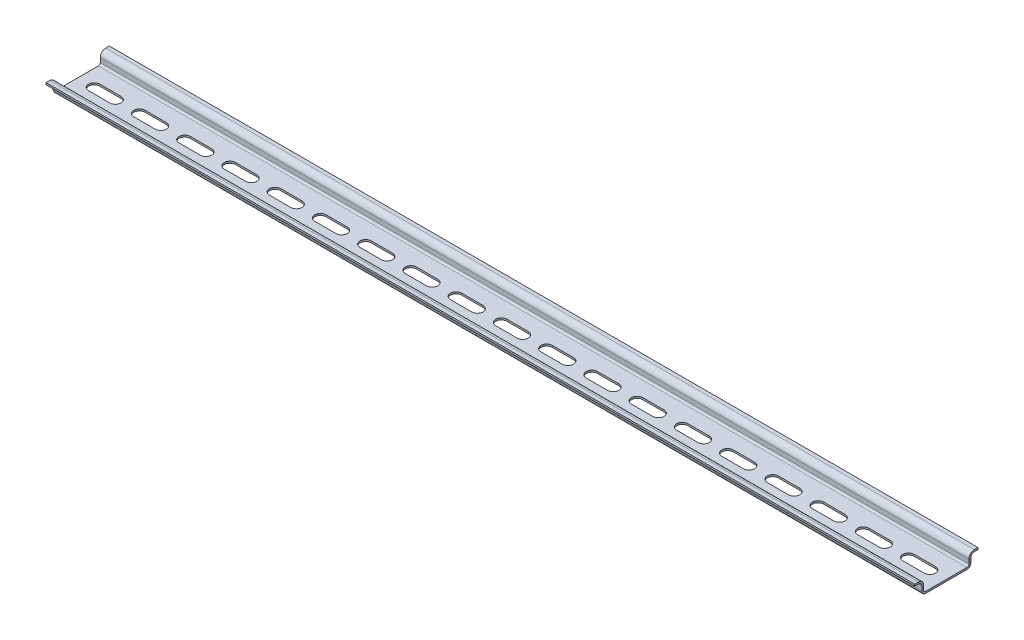
from build123d import *

# Parameters (mm, degrees)
EXTRUDE_THIN1_DEPTH      = 240
EXTRUDE_THIN1_DEPTH_BACK = 240
CUT_EXTRUDE1_REACH       = 242.754
LPATTERN1_COUNT          = 10
LPATTERN1_PITCH          = 25
LPATTERN1_COL_COUNT      = 10
LPATTERN1_COL_PITCH      = 25


with BuildPart() as part:
    # Sketch1 → Extrude-Thin1 (new, two sides: drawn at the far end of the back side and taken through both)
    with BuildSketch(Plane(origin=(0, 0, 0), x_dir=(0, 0, -1), z_dir=(1, 0, 0)).offset(-EXTRUDE_THIN1_DEPTH_BACK)):
        with BuildLine():
            Line((-17.5, 6.5), (-15.5, 6.5))
            ThreePointArc((-15.5, 6.5), (-14.085786438, 5.914213562), (-13.5, 4.5))
            Line((-13.5, 4.5), (-13.5, 2))
            ThreePointArc((-13.5, 2), (-12.914213562, 0.585786438), (-11.5, 0))
            Line((-11.5, 0), (11.5, 0))
            ThreePointArc((11.5, 0), (12.914213562, 0.585786438), (13.5, 2))
            Line((13.5, 2), (13.5, 4.5))
            ThreePointArc((13.5, 4.5), (14.085786438, 5.914213562), (15.5, 6.5))
            Line((15.5, 6.5), (17.5, 6.5))
            Line((17.5, 6.5), (17.5, 7.5))
            Line((17.5, 7.5), (15.5, 7.5))
            ThreePointArc((15.5, 7.5), (13.378679656, 6.621320344), (12.5, 4.5))
            Line((12.5, 4.5), (12.5, 2))
            ThreePointArc((12.5, 2), (12.207106781, 1.292893219), (11.5, 1))
            Line((11.5, 1), (-11.5, 1))
            ThreePointArc((-11.5, 1), (-12.207106781, 1.292893219), (-12.5, 2))
            Line((-12.5, 2), (-12.5, 4.5))
            ThreePointArc((-12.5, 4.5), (-13.378679656, 6.621320344), (-15.5, 7.5))
            Line((-15.5, 7.5), (-17.5, 7.5))
            Line((-17.5, 7.5), (-17.5, 6.5))
        make_face()
    extrude(amount=EXTRUDE_THIN1_DEPTH + EXTRUDE_THIN1_DEPTH_BACK)

    # Sketch2 → Cut-Extrude1 (cut, up to next)
    with BuildSketch(Plane.XZ, mode=Mode.PRIVATE) as cut_extrude1_sk1:
        with BuildLine():
            Line((-5.875, 3.125), (5.875, 3.125))
            ThreePointArc((5.875, 3.125), (9, 0), (5.875, -3.125))
            Line((5.875, -3.125), (-5.875, -3.125))
            ThreePointArc((-5.875, -3.125), (-9, 0), (-5.875, 3.125))
        make_face()
    cut_extrude1_tool1 = extrude(cut_extrude1_sk1.sketch, amount=-CUT_EXTRUDE1_REACH, mode=Mode.PRIVATE) & part.part
    cut_extrude1 = cut_extrude1_tool1.solids().sort_by_distance((0, 0, 0))[0]
    add(cut_extrude1, mode=Mode.SUBTRACT)

    # LPattern1: Cut-Extrude1 ×10
    with Locations(*[(i * LPATTERN1_PITCH, 0, 0) for i in range(1, LPATTERN1_COUNT)]):
        add(cut_extrude1, mode=Mode.SUBTRACT)

    # LPattern1 col: Cut-Extrude1 ×10
    with Locations(*[(-i * LPATTERN1_COL_PITCH, 0, 0) for i in range(1, LPATTERN1_COL_COUNT)]):
        add(cut_extrude1, mode=Mode.SUBTRACT)


solid = part.part
